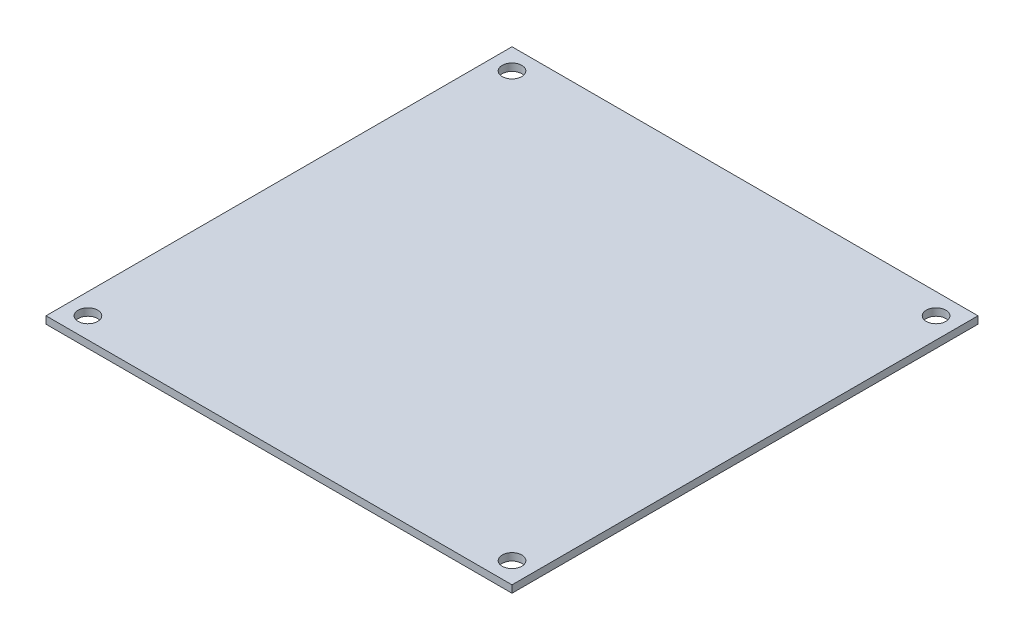
from build123d import *

# Parameters (mm, degrees)
SKETCH1_W           = 100
SKETCH1_H           = 100
SKETCH1_R           = 2.1
BOSS_EXTRUDE1_DEPTH = 1.57


with BuildPart() as part:
    # Sketch1 → Boss-Extrude1 (new body)
    with BuildSketch(Plane(origin=(0, 0, 0), x_dir=(1, 0, 0), z_dir=(0, 1, 0))):
        with Locations((50, 50)):
            Rectangle(SKETCH1_W, SKETCH1_H)
        with Locations(Location((4.5, 95.5, 0), (0, 0, 270))):
            Circle(SKETCH1_R, mode=Mode.SUBTRACT)
        with Locations(Location((95.5, 95.5, 0), (0, 0, 270))):
            Circle(SKETCH1_R, mode=Mode.SUBTRACT)
        with Locations(Location((95.5, 4.5, 0), (0, 0, 270))):
            Circle(SKETCH1_R, mode=Mode.SUBTRACT)
        with Locations(Location((4.5, 4.5, 0), (0, 0, 270))):
            Circle(SKETCH1_R, mode=Mode.SUBTRACT)
    extrude(amount=BOSS_EXTRUDE1_DEPTH)


solid = part.part
